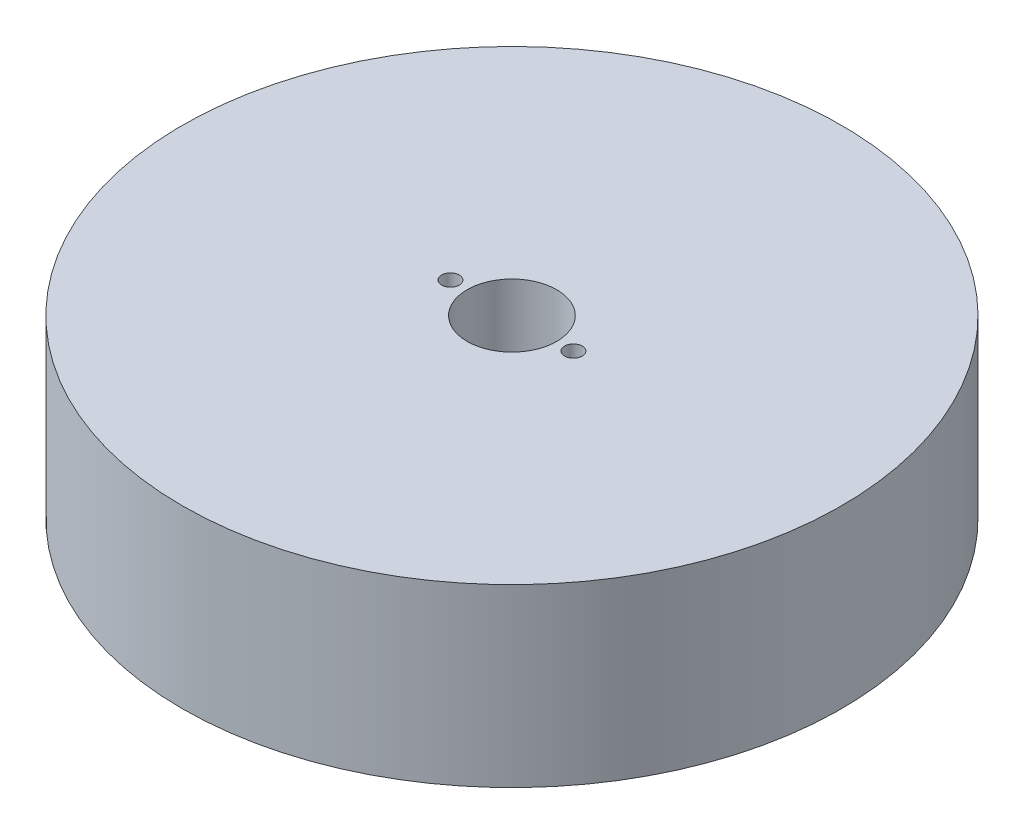
from build123d import *

# Parameters (mm, degrees)
SKETCH1_R           = 37.5
SKETCH1_R_2         = 5.1
SKETCH1_R_3         = 1
BOSS_EXTRUDE1_DEPTH = 20


with BuildPart() as part:
    # Sketch1 → Boss-Extrude1 (new body)
    with BuildSketch(Plane(origin=(0, 0, 0), x_dir=(1, 0, 0), z_dir=(0, 1, 0))):
        with Locations(Location((0, 0, 0), (0, 0, 270))):
            Circle(SKETCH1_R)
        with Locations(Location((0, 0, 0), (0, 0, 270))):
            Circle(SKETCH1_R_2, mode=Mode.SUBTRACT)
        with Locations(Location((-7, 0, 0), (0, 0, 270))):
            Circle(SKETCH1_R_3, mode=Mode.SUBTRACT)
        with Locations(Location((7, 0, 0), (0, 0, 270))):
            Circle(SKETCH1_R_3, mode=Mode.SUBTRACT)
    extrude(amount=BOSS_EXTRUDE1_DEPTH)


solid = part.part
